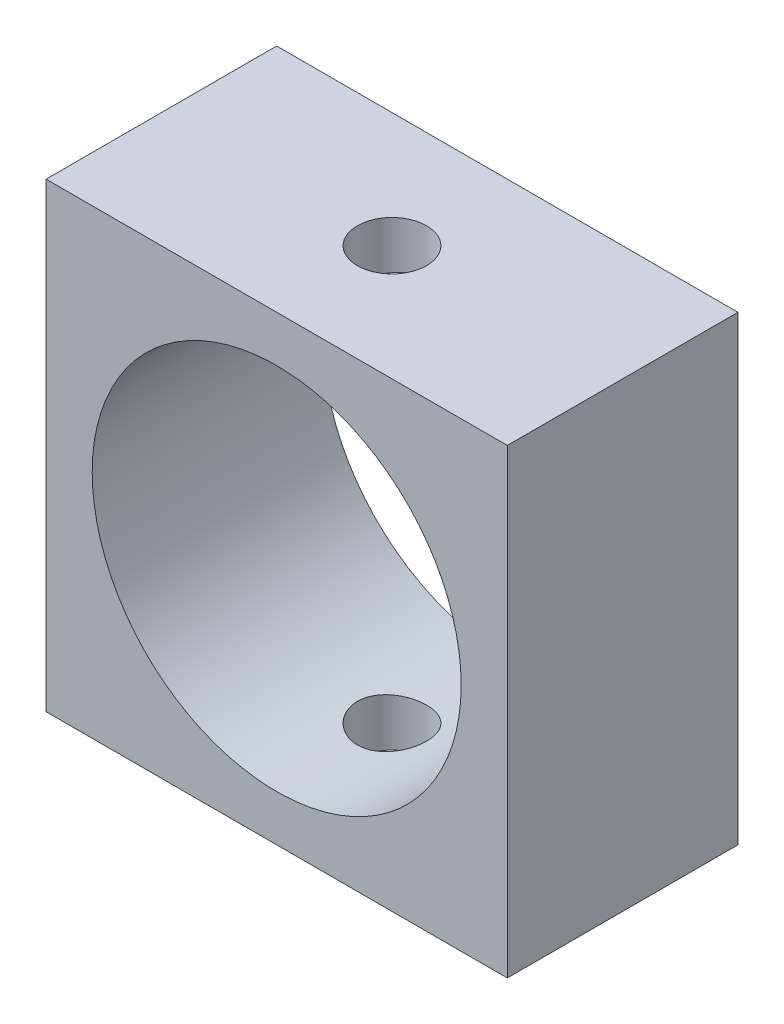
from build123d import *

# Parameters (mm, degrees)
SKETCH_1_W               = 20
SKETCH_1_H               = 20
SKETCH_1_R               = 8
EXTRUDE_1_DEPTH          = 10
CUT_EXTRUDE_1_DEPTH      = 18.320508076
CUT_EXTRUDE_1_DEPTH_BACK = 18.320508076
SKETCH_2_R               = 1.5


with BuildPart() as part:
    # 草图1 → 凸台-拉伸1 (new body)
    with BuildSketch(Plane.XY):
        Rectangle(SKETCH_1_W, SKETCH_1_H)
        Circle(SKETCH_1_R, mode=Mode.SUBTRACT)
    extrude(amount=EXTRUDE_1_DEPTH)

    # 草图2 → 切除-拉伸1 (cut, two sides: drawn at the far end of the back side and taken through both)
    with BuildSketch(Plane(origin=(0, 0, 0), x_dir=(1, 0, 0), z_dir=(0, 1, 0)).offset(-CUT_EXTRUDE_1_DEPTH_BACK)):
        with Locations(Location((0, -5, 0), (0, 0, 270))):
            Circle(SKETCH_2_R)
    extrude(amount=CUT_EXTRUDE_1_DEPTH + CUT_EXTRUDE_1_DEPTH_BACK, mode=Mode.SUBTRACT)


solid = part.part
